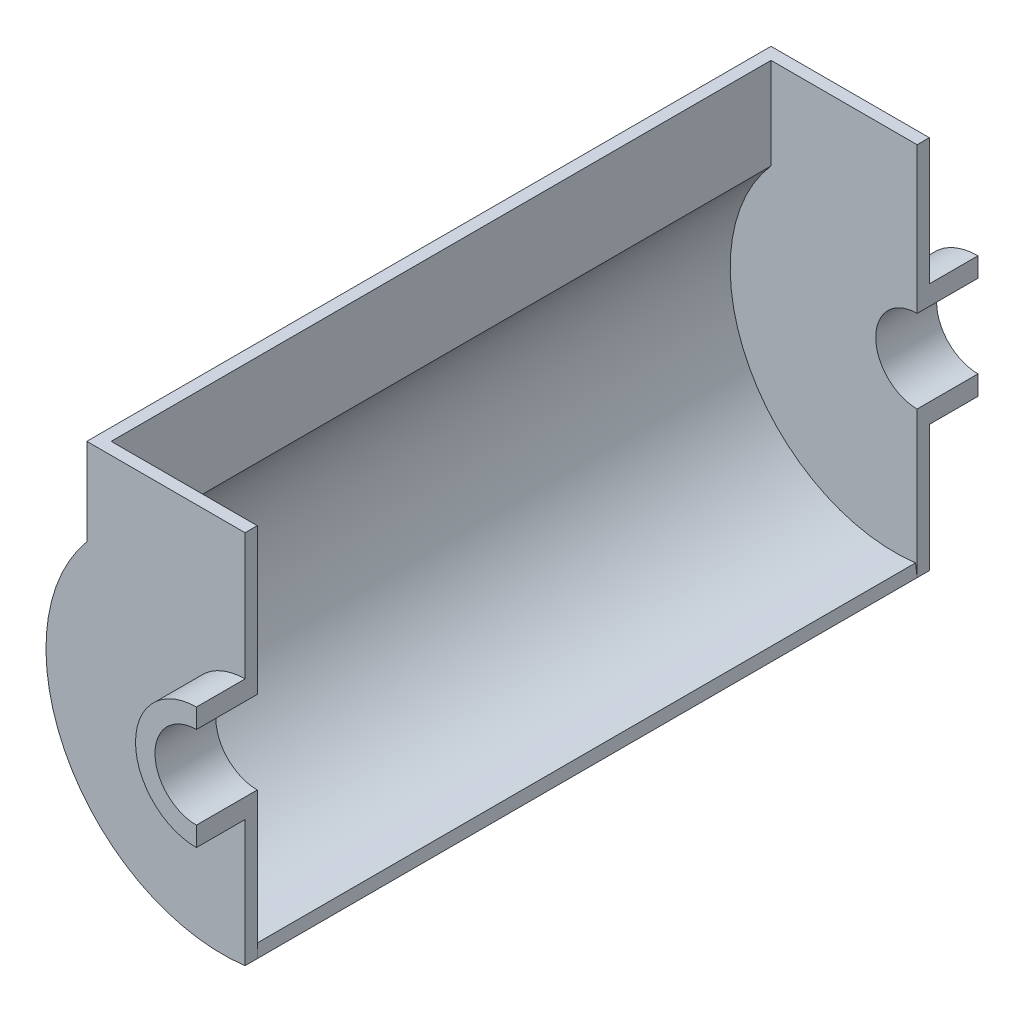
from build123d import *

# Parameters (mm, degrees)
BOSS_EXTRUDE1_DEPTH      = 20
BOSS_EXTRUDE1_DEPTH_BACK = 5
BOSS_EXTRUDE2_START      = -5
BOSS_EXTRUDE2_DEPTH      = 5
BOSS_EXTRUDE3_REACH      = 318.739


with BuildPart() as part:
    # Sketch1 → Boss-Extrude1 (new, two sides: drawn at the far end of the back side and taken through both)
    with BuildSketch(Plane.XY.offset(-BOSS_EXTRUDE1_DEPTH_BACK)):
        with BuildLine():
            Line((0, -25), (0, -17))
            ThreePointArc((0, -17), (-17, 0), (0, 17))
            Line((0, 17), (0, 25))
            ThreePointArc((0, 25), (-25, 0), (0, -25))
        make_face()
    extrude(amount=BOSS_EXTRUDE1_DEPTH + BOSS_EXTRUDE1_DEPTH_BACK)

    # Sketch2 → Boss-Extrude2 (add)
    with BuildSketch(Plane.XY.offset(BOSS_EXTRUDE2_START)):
        with BuildLine():
            Line((0, 25), (0, 77))
            Line((0, 77), (-65, 77))
            Line((-65, 77), (-65, 41.279534881))
            ThreePointArc((-65, 41.279534881), (-72.809730733, -40.012268415), (0, -77))
            Line((0, -77), (0, -25))
            ThreePointArc((0, -25), (-25, 0), (0, 25))
        make_face()
    extrude(amount=BOSS_EXTRUDE2_DEPTH)


with BuildPart() as body_2:
    # Mirror7: mirrored copy
    add(part.part.mirror(Plane.XY.offset(-140.5)))

    # Sketch3 → Boss-Extrude3 (add, up to next)
    with BuildSketch(Plane(origin=(0, 0, -5), x_dir=(-1, 0, 0), z_dir=(0, 0, -1)), mode=Mode.PRIVATE) as boss_extrude3_sk1:
        with BuildLine():
            Line((65, 77), (65, 41.279534881))
            ThreePointArc((65, 41.279534881), (72.809730733, -40.012268415), (0, -77))
            Line((0, -77), (0.639440705, -72.041057009))
            ThreePointArc((0.639440705, -72.041057009), (68.85136022, -36.821290054), (60, 39.434538382))
            Line((60, 39.434538382), (60, 77))
            Line((60, 77), (65, 77))
        make_face()
    boss_extrude3_tool1 = extrude(boss_extrude3_sk1.sketch, amount=BOSS_EXTRUDE3_REACH, mode=Mode.PRIVATE) - body_2.part

    add(part.part)  # Boss-Extrude3 merges part
    add(boss_extrude3_tool1.solids().sort_by_distance((-63.251104, 59.139767, -5))[0])


solid = body_2.part
